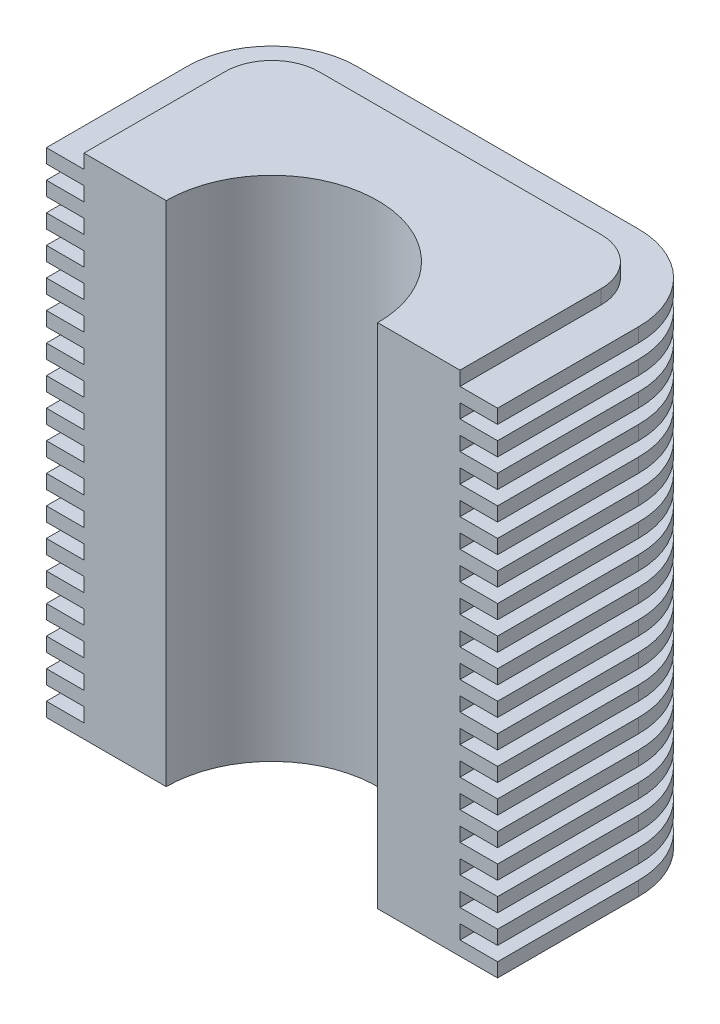
from build123d import *

# Parameters (mm, degrees)
DODANIE_WYCI_GNI_CIE1_DEPTH = 108
ZAOKR_GLENIE4_R             = 10
DODANIE_WYCI_GNI_CIE3_DEPTH = 3
SZYK_LINIOWY1_COUNT         = 18
SZYK_LINIOWY1_PITCH         = 6


with BuildPart() as part:
    # Szkic1 → Dodanie-wyciągnięcie1 (new body)
    with BuildSketch(Plane(origin=(0, 0, 0), x_dir=(1, 0, 0), z_dir=(0, 1, 0))):
        with BuildLine():
            Line((-22.5, 0), (-40, 0))
            Line((-40, 0), (-40, 40))
            Line((-40, 40), (40, 40))
            Line((40, 40), (40, 0))
            Line((40, 0), (22.5, 0))
            ThreePointArc((22.5, 0), (0, 22.5), (-22.5, 0))
        make_face()
    extrude(amount=DODANIE_WYCI_GNI_CIE1_DEPTH)

    # Zaokrąglenie4
    zaokr_glenie4_edges = [part.edges().sort_by_distance(p)[0] for p in [
        (-40, 54, -40),
        (40, 54, -40),
    ]]
    fillet(zaokr_glenie4_edges, radius=ZAOKR_GLENIE4_R)

    # Szkic3 → Dodanie-wyciągnięcie3 (add)
    with BuildSketch(Plane(origin=(0, 0, 0), x_dir=(1, 0, 0), z_dir=(0, 1, 0))):
        with BuildLine():
            Line((-40, 0), (-48, 0))
            Line((-48, 0), (-48, 30))
            ThreePointArc((-48, 30), (-42.727922061, 42.727922061), (-30, 48))
            Line((-30, 48), (30, 48))
            ThreePointArc((30, 48), (42.727922061, 42.727922061), (48, 30))
            Line((48, 30), (48, 0))
            Line((48, 0), (40, 0))
            Line((40, 0), (22.5, 0))
            ThreePointArc((22.5, 0), (0, 22.5), (-22.5, 0))
            Line((-22.5, 0), (-40, 0))
        make_face()
    dodanie_wyci_gni_cie3 = extrude(amount=DODANIE_WYCI_GNI_CIE3_DEPTH)

    # Szyk liniowy1: Dodanie-wyciągnięcie3 ×18
    with Locations(*[(0, i * SZYK_LINIOWY1_PITCH, 0) for i in range(1, SZYK_LINIOWY1_COUNT)]):
        add(dodanie_wyci_gni_cie3)


solid = part.part
